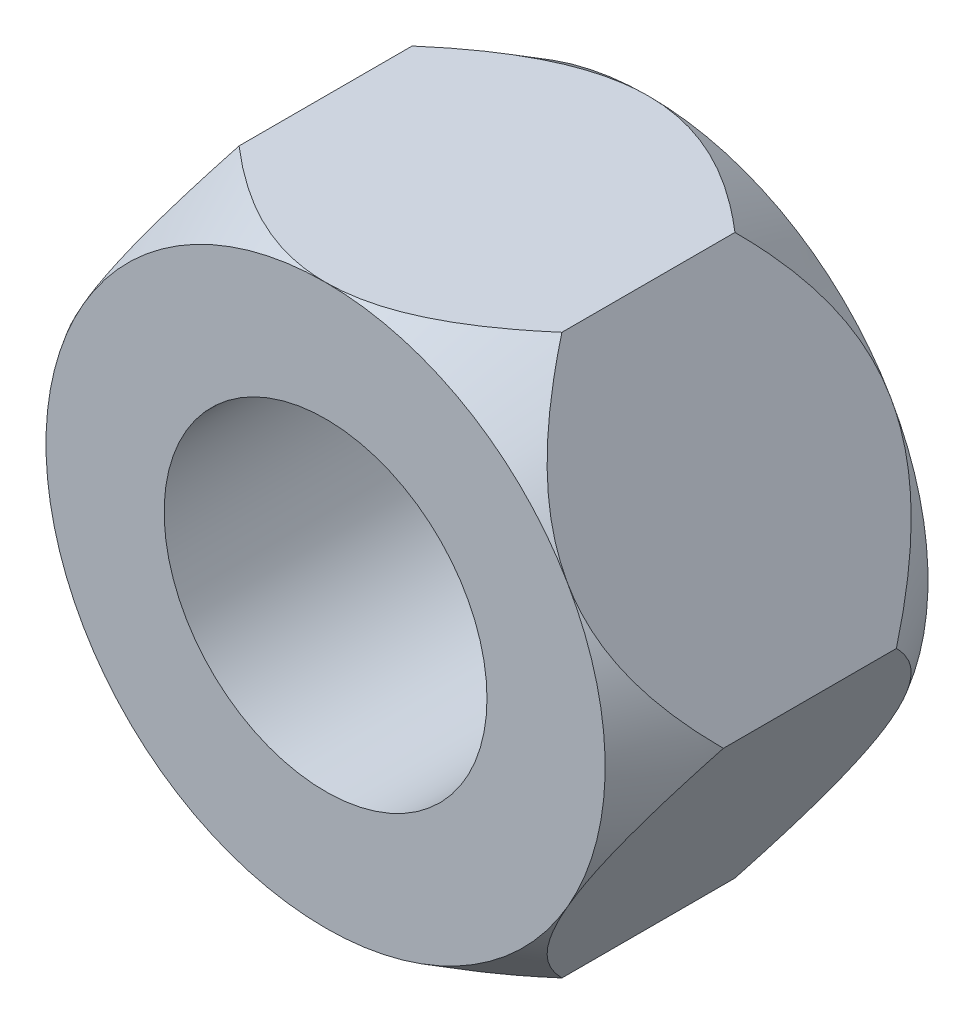
from build123d import *

# Parameters (mm, degrees)
BOSS_EXTRUDE1_DEPTH     = 4
SKETCH2_OUTSIDE_W       = 31.764
SKETCH2_OUTSIDE_H       = 29.62
SKETCH2_OUTSIDE_R       = 6.92820323
CUT_EXTRUDE1_DEPTH      = 8
CUT_EXTRUDE1_DRAFT      = -30
MIRROR1_COPY_1_SKETCH_W = 31.764
MIRROR1_COPY_1_SKETCH_H = 29.62
MIRROR1_COPY_1_SKETCH_R = 6.92820323
MIRROR1_COPY_1_DEPTH    = 8
MIRROR1_COPY_1_DRAFT    = -30
SKETCH3_R               = 4
CUT_EXTRUDE2_DEPTH      = 8


with BuildPart() as part:
    # Sketch1 → Boss-Extrude1 (new, symmetric)
    with BuildSketch(Plane.XY):
        Polygon((8, 0), (4, 6.92820323), (-4, 6.92820323), (-8, 0), (-4, -6.92820323), (4, -6.92820323), align=None)
    extrude(amount=BOSS_EXTRUDE1_DEPTH, both=True)


with BuildPart() as cut_extrude1_tool:
    # Sketch2 outside → Cut-Extrude1 (with draft: the straight prism first)
    with BuildSketch(Plane.XY.offset(4)):
        Rectangle(SKETCH2_OUTSIDE_W, SKETCH2_OUTSIDE_H)
        Circle(SKETCH2_OUTSIDE_R, mode=Mode.SUBTRACT)
    extrude(amount=-CUT_EXTRUDE1_DEPTH)
    # Cut-Extrude1: the draft: its side faces are tilted about the plane it starts from
    cut_extrude1_sides = [cut_extrude1_tool.faces().sort_by_distance(p)[0] for p in [
        (0, -14.81, 0),
        (15.882, 0, 0),
        (0, 14.81, 0),
        (-15.882, 0, 0),
        (-6.92820323, 0, 0),
    ]]
    draft(cut_extrude1_sides, Plane.XY.offset(4), CUT_EXTRUDE1_DRAFT)


with BuildPart() as part_1:
    add(part.part)

    # Cut-Extrude1: cut by cut_extrude1_tool
    add(cut_extrude1_tool.part, mode=Mode.SUBTRACT)


with BuildPart() as mirror1_copy_1_tool:
    # Mirror1 copy 1 sketch → Mirror1 copy 1 (with draft: the straight prism first)
    with BuildSketch(Plane(origin=(0, 0, -4), x_dir=(1, 0, 0), z_dir=(0, 0, -1))):
        Rectangle(MIRROR1_COPY_1_SKETCH_W, MIRROR1_COPY_1_SKETCH_H)
        Circle(MIRROR1_COPY_1_SKETCH_R, mode=Mode.SUBTRACT)
    extrude(amount=-MIRROR1_COPY_1_DEPTH)
    # Mirror1 copy 1: the draft: its side faces are tilted about the plane it starts from
    mirror1_copy_1_sides = [mirror1_copy_1_tool.faces().sort_by_distance(p)[0] for p in [
        (0, -14.81, 0),
        (15.882, 0, 0),
        (0, 14.81, 0),
        (-15.882, 0, 0),
        (-6.92820323, 0, 0),
    ]]
    draft(mirror1_copy_1_sides, Plane(origin=(0, 0, -4), x_dir=(1, 0, 0), z_dir=(0, 0, -1)), MIRROR1_COPY_1_DRAFT)


with BuildPart() as part_2:
    add(part_1.part)

    # Mirror1 copy 1: cut by mirror1_copy_1_tool
    add(mirror1_copy_1_tool.part, mode=Mode.SUBTRACT)

    # Sketch3 → Cut-Extrude2 (cut)
    with BuildSketch(Plane.XY.offset(4)):
        Circle(SKETCH3_R)
    extrude(amount=-CUT_EXTRUDE2_DEPTH, mode=Mode.SUBTRACT)


solid = part_2.part
